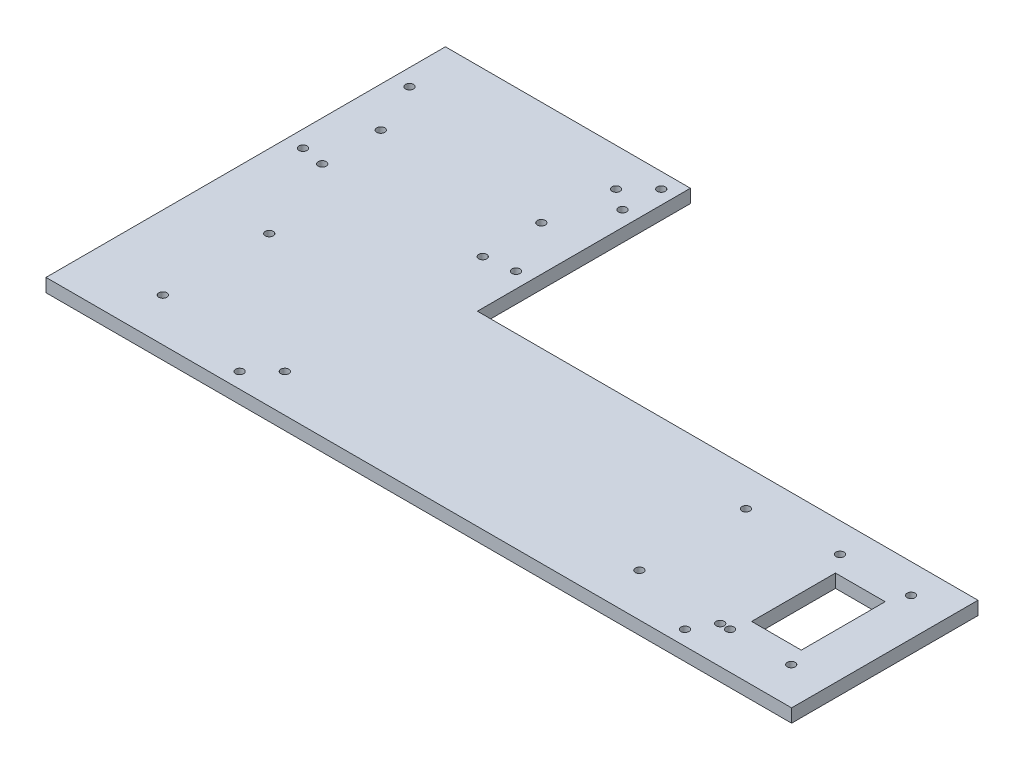
from build123d import *

# Parameters (mm, degrees)
SKETCH1_R           = 1.5
SKETCH1_W           = 18.658985537
SKETCH1_H           = 31.487038094
BOSS_EXTRUDE1_DEPTH = 5


with BuildPart() as part:
    # Sketch1 → Boss-Extrude1 (new body)
    with BuildSketch(Plane(origin=(0, 0, 0), x_dir=(1, 0, 0), z_dir=(0, 1, 0))):
        Polygon((-124.555160142, -60.782918149), (155.444839858, -60.782918149), (155.444839858, 9.217081851), (-32.555160142, 9.217081851), (-32.555160142, 89.217081851), (-124.555160142, 89.217081851), align=None)
        with Locations(Location((-96.88048066, -44.579371447, 0), (0, 0, 270))):
            Circle(SKETCH1_R, mode=Mode.SUBTRACT)
        with Locations(Location((-57.609979708, -55.025558837, 0), (0, 0, 270))):
            Circle(SKETCH1_R, mode=Mode.SUBTRACT)
        with Locations(Location((-49.124698334, -46.540277462, 0), (0, 0, 270))):
            Circle(SKETCH1_R, mode=Mode.SUBTRACT)
        with Locations(Location((-96.88048066, -4.623906574, 0), (0, 0, 270))):
            Circle(SKETCH1_R, mode=Mode.SUBTRACT)
        with Locations(Location((82.11951934, -44.623906574, 0), (0, 0, 270))):
            Circle(SKETCH1_R, mode=Mode.SUBTRACT)
        with Locations(Location((109.860128873, -55.261198979, 0), (0, 0, 270))):
            Circle(SKETCH1_R, mode=Mode.SUBTRACT)
        with Locations(Location((114.620218271, -46.782918149, 0), (0, 0, 270))):
            Circle(SKETCH1_R, mode=Mode.SUBTRACT)
        with Locations(Location((118.345410248, -46.775917605, 0), (0, 0, 270))):
            Circle(SKETCH1_R, mode=Mode.SUBTRACT)
        with Locations(Location((141.300092758, -46.782918149, 0), (0, 0, 270))):
            Circle(SKETCH1_R, mode=Mode.SUBTRACT)
        with Locations((129.159877134, -24.440324762)):
            Rectangle(SKETCH1_W, SKETCH1_H, mode=Mode.SUBTRACT)
        with Locations(Location((82.11951934, -4.623906574, 0), (0, 0, 270))):
            Circle(SKETCH1_R, mode=Mode.SUBTRACT)
        with Locations(Location((114.620218271, -1.782918149, 0), (0, 0, 270))):
            Circle(SKETCH1_R, mode=Mode.SUBTRACT)
        with Locations(Location((141.300092758, -1.782918149, 0), (0, 0, 270))):
            Circle(SKETCH1_R, mode=Mode.SUBTRACT)
        with Locations(Location((-37.752255096, 83.459722538, 0), (0, 0, 270))):
            Circle(SKETCH1_R, mode=Mode.SUBTRACT)
        with Locations(Location((-109.616514697, 27.990725731, 0), (0, 0, 270))):
            Circle(SKETCH1_R, mode=Mode.SUBTRACT)
        with Locations(Location((-118.326917326, 29.495275711, 0), (0, 0, 270))):
            Circle(SKETCH1_R, mode=Mode.SUBTRACT)
        with Locations(Location((-109.616514697, 49.990725731, 0), (0, 0, 270))):
            Circle(SKETCH1_R, mode=Mode.SUBTRACT)
        with Locations(Location((-49.316514697, 27.990725731, 0), (0, 0, 270))):
            Circle(SKETCH1_R, mode=Mode.SUBTRACT)
        with Locations(Location((-38.326917326, 29.495275711, 0), (0, 0, 270))):
            Circle(SKETCH1_R, mode=Mode.SUBTRACT)
        with Locations(Location((-49.316514697, 49.990725731, 0), (0, 0, 270))):
            Circle(SKETCH1_R, mode=Mode.SUBTRACT)
        with Locations(Location((-118.326917326, 69.495275711, 0), (0, 0, 270))):
            Circle(SKETCH1_R, mode=Mode.SUBTRACT)
        with Locations(Location((-38.326917326, 69.495275711, 0), (0, 0, 270))):
            Circle(SKETCH1_R, mode=Mode.SUBTRACT)
        with Locations(Location((-46.23753647, 74.974441163, 0), (0, 0, 270))):
            Circle(SKETCH1_R, mode=Mode.SUBTRACT)
    extrude(amount=BOSS_EXTRUDE1_DEPTH)


solid = part.part
